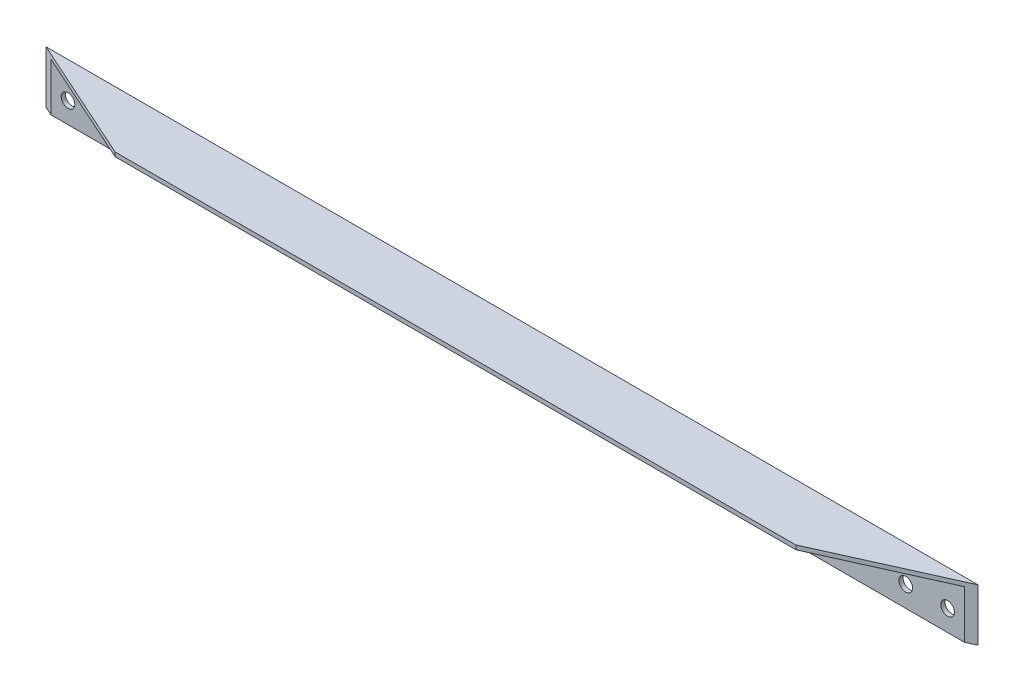
from build123d import *

# Parameters (mm, degrees)
SKETCH_1_W          = 1780
SKETCH_1_H          = 100
SKETCH_1_R          = 13
EXTRUDE_522_DEPTH   = 8
SKETCH_2_W          = 1780
SKETCH_2_H          = 8
EXTRUDE_1_DEPTH     = 100
CUT_EXTRUDE_1_DEPTH = 903.088687436


with BuildPart() as part:
    # 草图1 → Extrude 522 (new body)
    with BuildSketch(Plane.XY):
        with Locations((0, 50)):
            Rectangle(SKETCH_1_W, SKETCH_1_H)
        with Locations((840, 40)):
            Circle(SKETCH_1_R, mode=Mode.SUBTRACT)
        with Locations((760, 40)):
            Circle(SKETCH_1_R, mode=Mode.SUBTRACT)
        with Locations(Location((-840, 40, 0), (0, 0, 180))):
            Circle(SKETCH_1_R, mode=Mode.SUBTRACT)
        with Locations(Location((-760, 40, 0), (0, 0, 180))):
            Circle(SKETCH_1_R, mode=Mode.SUBTRACT)
    extrude(amount=EXTRUDE_522_DEPTH)

    # 草图2 → 凸台-拉伸1 (add)
    with BuildSketch(Plane.XY.offset(8)):
        with Locations((0, 96)):
            Rectangle(SKETCH_2_W, SKETCH_2_H)
    extrude(amount=EXTRUDE_1_DEPTH)

    # 草图3 → 切除-拉伸1 (cut, through all)
    with BuildSketch(Plane(origin=(0, 100, 0), x_dir=(-1, 0, 0), z_dir=(0, 1, 0))):
        Polygon((-650, 108), (-890, 0), (-890, 108), align=None)
        Polygon((890, 108), (650, 108), (890, 0), align=None)
    extrude(amount=-CUT_EXTRUDE_1_DEPTH, mode=Mode.SUBTRACT)


solid = part.part
